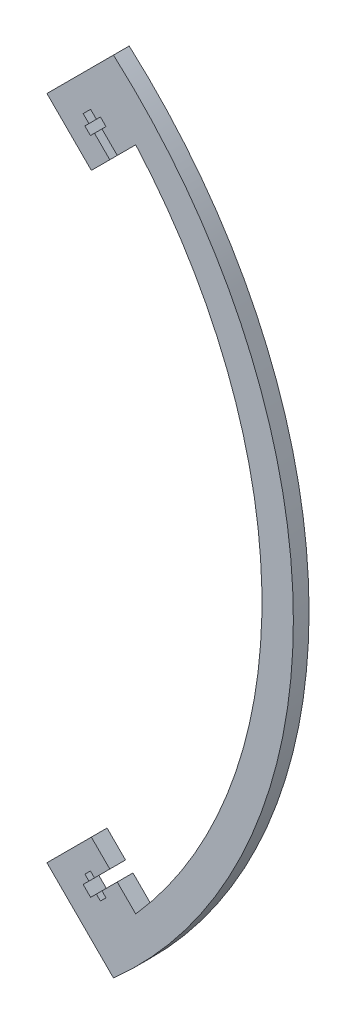
from build123d import *

# Parameters (mm, degrees)
BOSS_EXTRUDE1_DEPTH = 6.35
BOSS_EXTRUDE3_START = -6.35
BOSS_EXTRUDE3_DEPTH = 6.35
CUT_EXTRUDE1_DEPTH  = 268.119964262


with BuildPart() as part:
    # Sketch1 → Boss-Extrude1 (new body)
    with BuildSketch(Plane.XY):
        with BuildLine():
            Line((143.360416784, 116.919323836), (134.344167558, 107.903074611))
            ThreePointArc((134.344167558, 107.903074611), (181.249035113, -21.950964887), (134.344167558, -151.805004385))
            Line((134.344167558, -151.805004385), (143.360416784, -160.82125361))
            ThreePointArc((143.360416784, -160.82125361), (193.949035113, -21.950964887), (143.360416784, 116.919323836))
        make_face()
    extrude(amount=BOSS_EXTRUDE1_DEPTH)

    # Sketch4 → Boss-Extrude3 (add)
    with BuildSketch(Plane.XY.offset(6.35).offset(BOSS_EXTRUDE3_START)):
        with BuildLine():
            Line((143.360416784, -160.82125361), (134.344167558, -151.805004385))
            ThreePointArc((134.344167558, -151.805004385), (132.290059148, -154.238328247), (130.198070847, -156.639163795))
            Line((130.198070847, -156.639163795), (139.193969877, -165.635062824))
            ThreePointArc((139.193969877, -165.635062824), (141.294938047, -163.24351662), (143.360416784, -160.82125361))
        make_face()
        with BuildLine():
            ThreePointArc((139.193969877, -165.635062824), (130.46291295, -174.865384883), (121.204013939, -183.56613137))
            Line((121.204013939, -183.56613137), (94.292689271, -156.654806703))
            Line((94.292689271, -156.654806703), (112.253201513, -138.694294461))
            Line((112.253201513, -138.694294461), (139.193969877, -165.635062824))
        make_face()
    boss_extrude3 = extrude(amount=BOSS_EXTRUDE3_DEPTH)

    # Sketch5 → Cut-Extrude1 (cut, through all)
    with BuildSketch(Plane.XY.offset(6.35)):
        Polygon((122.734319209, -149.175412156), (121.22563618, -147.666729128), (110.449328835, -158.443036473), (111.958011863, -159.951719502), (114.292878455, -157.61685291), (115.927285069, -159.251259524), (118.172349099, -157.006195494), (116.537942485, -155.37178888), align=None)
        Polygon((110.449328835, -158.443036473), (121.22563618, -147.666729128), (119.716953152, -146.1580461), (113.520576428, -152.354422823), (111.886169814, -150.720016209), (109.641105784, -152.965080239), (111.275512398, -154.599486854), (108.940645807, -156.934353445), align=None)
    cut_extrude1 = extrude(amount=-CUT_EXTRUDE1_DEPTH, mode=Mode.SUBTRACT)

    # Mirror2: Boss-Extrude3, Cut-Extrude1 across plane
    add(boss_extrude3.mirror(Plane.ZX.offset(-21.950964887)))
    add(cut_extrude1.mirror(Plane.ZX.offset(-21.950964887)), mode=Mode.SUBTRACT)


solid = part.part
